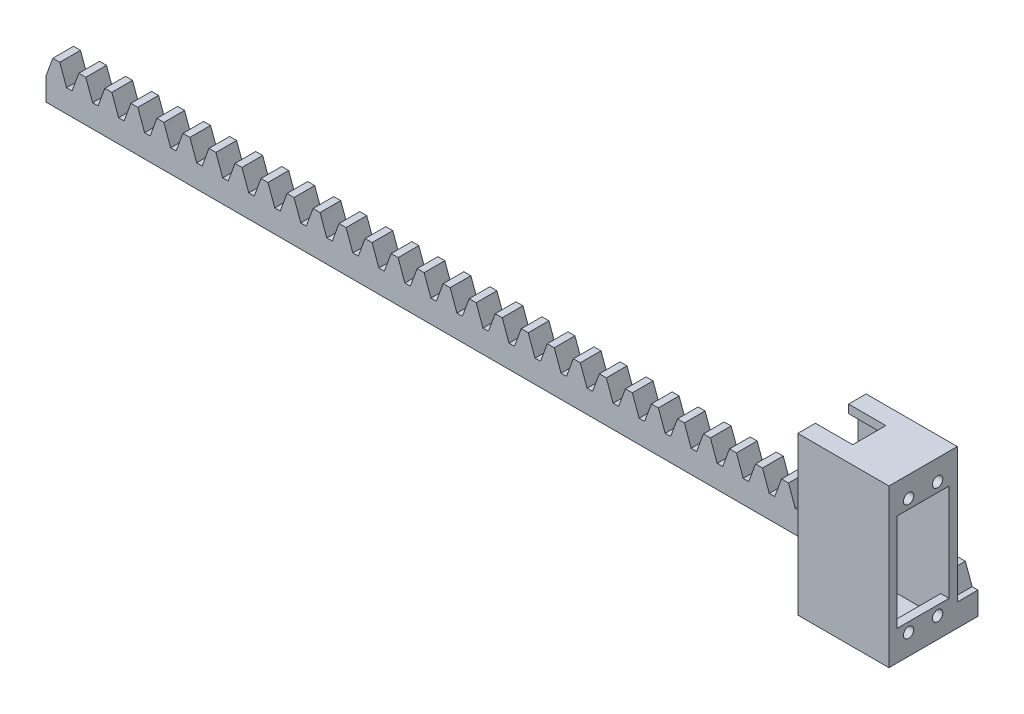
from build123d import *

# Parameters (mm, degrees)
SKETCH_1_W             = 220
SKETCH_1_H             = 5.5
EXTRUDE_1_DEPTH        = 5
EXTRUDE_2_DEPTH        = 5
PATTERN_LINEAR_1_COUNT = 35
PATTERN_LINEAR_1_PITCH = 6.283185307
SKETCH_4_W             = 16.5
SKETCH_4_H             = 38
SKETCH_4_R             = 1.25
SKETCH_4_W_2           = 12.5
SKETCH_4_H_2           = 23.5
EXTRUDE_1_2_DEPTH      = 22
SKETCH_5_W             = 12.5
SKETCH_5_H             = 34
CUT_EXTRUDE_1_DEPTH    = 20
SKETCH_6_W             = 9
SKETCH_6_H             = 8
CUT_EXTRUDE_2_DEPTH    = 225.290548174


with BuildPart() as part:
    # 草图1 → Extrude 1 (new body)
    with BuildSketch(Plane.XY):
        with Locations((110, -2.75)):
            Rectangle(SKETCH_1_W, SKETCH_1_H)
    extrude(amount=EXTRUDE_1_DEPTH)

    # 草图2 → 拉伸2 (add)
    with BuildSketch(Plane.XY.offset(5)):
        Polygon((0, 0), (1.637866054, 4.5), (3.323577771, 4.5), (4.961443825, 0), align=None)
    extrude_2 = extrude(amount=-EXTRUDE_2_DEPTH)

    # 阵列(线性)1: 拉伸2 ×35
    with Locations(*[(i * PATTERN_LINEAR_1_PITCH, 0, 0) for i in range(1, PATTERN_LINEAR_1_COUNT)]):
        add(extrude_2)

    # 草图4 → Extrude 1 2 (add)
    with BuildSketch(Plane(origin=(220, 0, 0), x_dir=(0, 0, -1), z_dir=(1, 0, 0))):
        with Locations((-13.25, 13.5)):
            Rectangle(SKETCH_4_W, SKETCH_4_H)
        with Locations((-16.75, 27.5)):
            Circle(SKETCH_4_R, mode=Mode.SUBTRACT)
        with Locations(Location((-9.75, 27.5, 0), (0, 0, 180))):
            Circle(SKETCH_4_R, mode=Mode.SUBTRACT)
        with Locations((-9.75, -0.5)):
            Circle(SKETCH_4_R, mode=Mode.SUBTRACT)
        with Locations(Location((-16.75, -0.5, 0), (0, 0, 180))):
            Circle(SKETCH_4_R, mode=Mode.SUBTRACT)
        with Locations((-13.25, 13.5)):
            Rectangle(SKETCH_4_W_2, SKETCH_4_H_2, mode=Mode.SUBTRACT)
    extrude(amount=-EXTRUDE_1_2_DEPTH)

    # 草图5 → 切除-拉伸1 (cut)
    with BuildSketch(Plane.ZY.offset(-198)):
        with Locations((13.25, 13.5)):
            Rectangle(SKETCH_5_W, SKETCH_5_H)
    extrude(amount=-CUT_EXTRUDE_1_DEPTH, mode=Mode.SUBTRACT)

    # 草图6 → 切除-拉伸2 (cut, through all)
    with BuildSketch(Plane(origin=(0, 32.5, 0), x_dir=(1, 0, 0), z_dir=(0, 1, 0))):
        with Locations((202.5, -13.25)):
            Rectangle(SKETCH_6_W, SKETCH_6_H)
    extrude(amount=-CUT_EXTRUDE_2_DEPTH, mode=Mode.SUBTRACT)


solid = part.part
